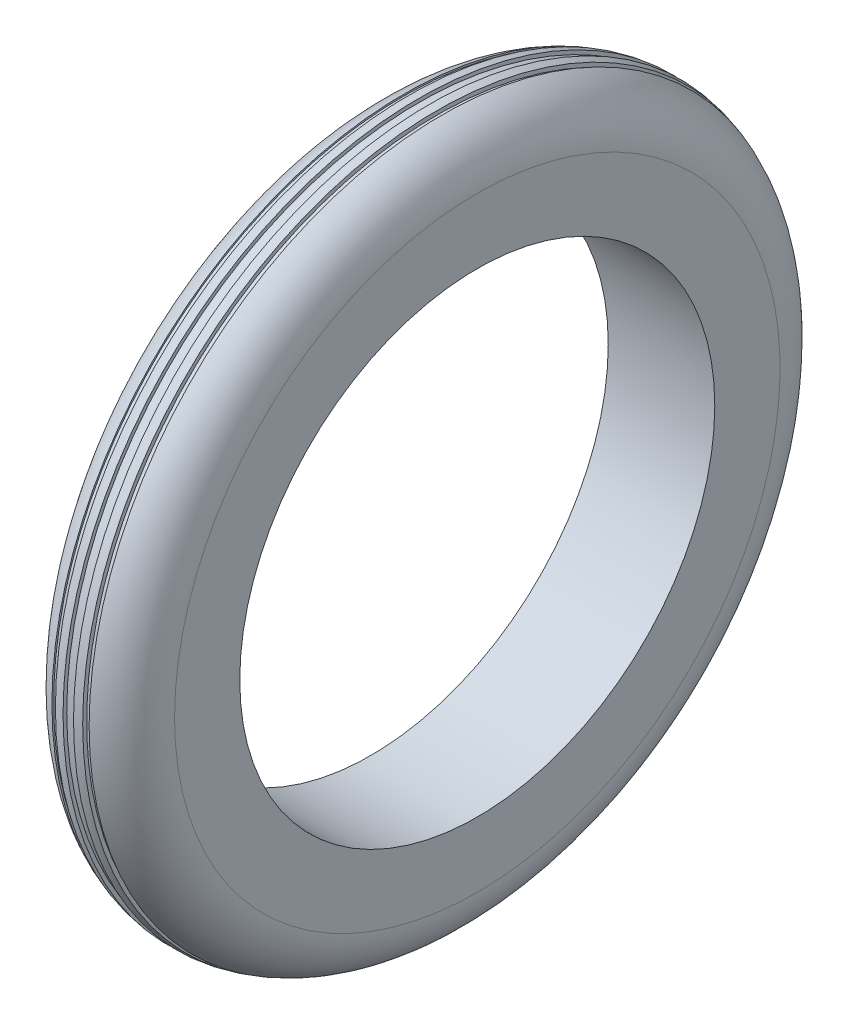
from build123d import *

# Parameters (mm, degrees)
SKETCH2_W   = 1.982852704
SKETCH2_H   = 4.045354148
SKETCH2_W_2 = 0.933543265
SKETCH2_H_2 = 4.667716324
SKETCH2_W_3 = 1.011338537


with BuildPart() as part:
    # Sketch1 → Revolve1 (revolve)
    with BuildSketch(Plane.XY, mode=Mode.PRIVATE) as revolve1_sk:
        with BuildLine():
            Line((-10.091533181, 57.356979405), (-10.091533181, 45))
            Line((-10.091533181, 45), (10.091533181, 45))
            Line((10.091533181, 45), (10.091533181, 57.356979405))
            ThreePointArc((10.091533181, 57.356979405), (0, 67.448512586), (-10.091533181, 57.356979405))
        make_face()
    revolve(revolve1_sk.sketch.rotate(Axis((-52.285660481, 0, 0), (1, 0, 0)), 90), axis=Axis((-52.285660481, 0, 0), (1, 0, 0)))

    # Sketch2 → Cut-Revolve1 (revolve, cut)
    with BuildSketch(Plane.XY, mode=Mode.PRIVATE) as cut_revolve1_sk:
        with Locations((0, 68.723356154)):
            Rectangle(SKETCH2_W, SKETCH2_H)
        with Locations((2.937234888, 68.723356154)):
            Rectangle(SKETCH2_W_2, SKETCH2_H_2)
        with Locations((-3.286386879, 68.723356154)):
            Rectangle(SKETCH2_W_3, SKETCH2_H_2)
    revolve(cut_revolve1_sk.sketch.rotate(Axis((38.367575356, 0, 0), (1, 0, 0)), 90), axis=Axis((38.367575356, 0, 0), (1, 0, 0)), mode=Mode.SUBTRACT)


solid = part.part
